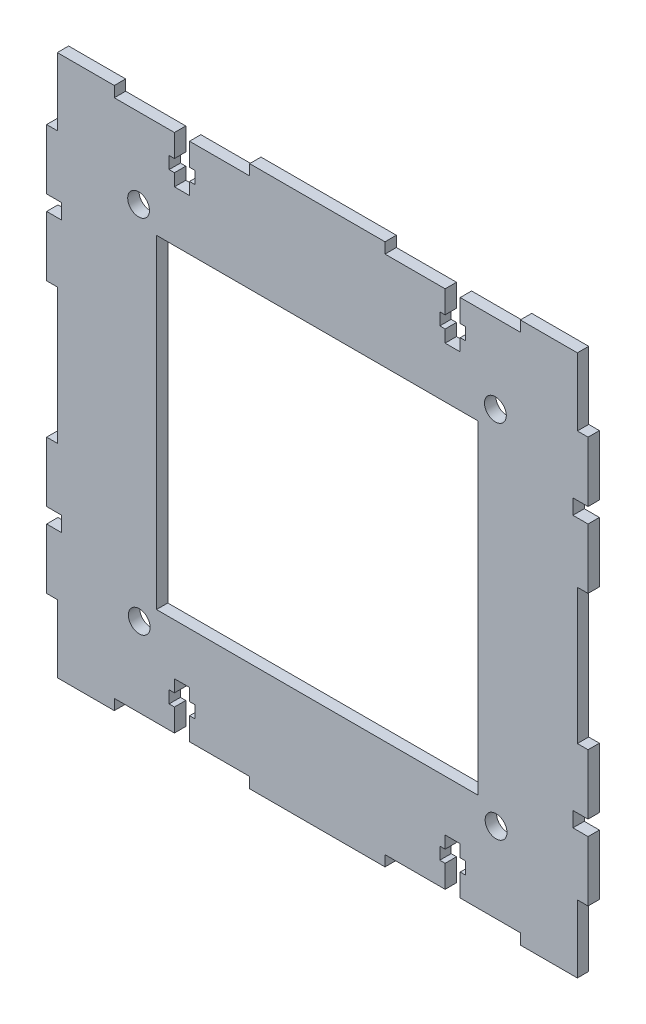
from build123d import *

# Parameters (mm, degrees)
SKETCH1_R           = 3.05
SKETCH1_W           = 89.973098966
SKETCH1_H           = 90.646237781
BOSS_EXTRUDE1_DEPTH = 3.175


with BuildPart() as part:
    # Sketch1 → Boss-Extrude1 (new body)
    with BuildSketch(Plane.XY):
        Polygon((134.366277122, 315.825463089), (134.366277122, 296.898356199), (131.385630367, 296.898356199), (131.385630367, 280.082540759), (135.608213269, 280.082540759), (135.608213269, 277.971249308), (135.608213269, 275.859957857), (131.385630367, 275.859957857), (131.385630367, 259.044142417), (134.366277122, 259.044142417), (134.366277122, 221.189928636), (131.385630367, 221.189928636), (131.385630367, 204.374113196), (135.608213269, 204.374113196), (135.608213269, 202.262821745), (135.608213269, 200.151530294), (131.385630367, 200.151530294), (131.385630367, 183.335714854), (134.366277122, 183.335714854), (134.366277122, 164.408607964), (150.312737258, 164.408607964), (150.312737258, 167.389254718), (167.128552698, 167.389254718), (167.128552698, 173.698290348), (165.63822932, 173.698290348), (165.63822932, 177.126034116), (167.128552698, 177.126034116), (167.128552698, 180.553777884), (171.3511356, 180.553777884), (171.3511356, 177.126034116), (172.841458977, 177.126034116), (172.841458977, 173.698290348), (171.3511356, 173.698290348), (171.3511356, 167.389254718), (188.166951039, 167.389254718), (188.166951039, 164.408607964), (226.021164821, 164.408607964), (226.021164821, 167.389254718), (242.83698026, 167.389254718), (242.83698026, 173.698290348), (241.346656883, 173.698290348), (241.346656883, 177.126034116), (242.83698026, 177.126034116), (242.83698026, 180.553777884), (247.059563162, 180.553777884), (247.059563162, 177.126034116), (248.54988654, 177.126034116), (248.54988654, 173.698290348), (247.059563162, 173.698290348), (247.059563162, 167.389254718), (263.875378602, 167.389254718), (263.875378602, 164.408607964), (279.821838738, 164.408607964), (279.821838738, 183.335714854), (282.802485493, 183.335714854), (282.802485493, 200.151530294), (278.579902591, 200.151530294), (278.579902591, 202.262821745), (278.579902591, 204.374113196), (282.802485493, 204.374113196), (282.802485493, 221.189928636), (279.821838738, 221.189928636), (279.821838738, 259.044142417), (282.802485493, 259.044142417), (282.802485493, 275.859957857), (278.579902591, 275.859957857), (278.579902591, 277.971249308), (278.579902591, 280.082540759), (282.802485493, 280.082540759), (282.802485493, 296.898356199), (279.821838738, 296.898356199), (279.821838738, 315.825463089), (263.875378602, 315.825463089), (263.875378602, 312.844816335), (247.059563162, 312.844816335), (247.059563162, 306.535780705), (248.54988654, 306.535780705), (248.54988654, 303.108036937), (247.059563162, 303.108036937), (247.059563162, 299.680293169), (242.83698026, 299.680293169), (242.83698026, 303.108036937), (241.346656883, 303.108036937), (241.346656883, 306.535780705), (242.83698026, 306.535780705), (242.83698026, 312.844816335), (226.021164821, 312.844816335), (226.021164821, 315.825463089), (188.166951039, 315.825463089), (188.166951039, 312.844816335), (171.3511356, 312.844816335), (171.3511356, 306.535780705), (172.841458977, 306.535780705), (172.841458977, 303.108036937), (171.3511356, 303.108036937), (171.3511356, 299.680293169), (167.128552698, 299.680293169), (167.128552698, 303.108036937), (165.63822932, 303.108036937), (165.63822932, 306.535780705), (167.128552698, 306.535780705), (167.128552698, 312.844816335), (150.312737258, 312.844816335), (150.312737258, 315.825463089), align=None)
        with Locations((157.107508447, 290.442033214)):
            Circle(SKETCH1_R, mode=Mode.SUBTRACT)
        with Locations(Location((256.893063872, 290.685795432, 0), (0, 0, 180))):
            Circle(SKETCH1_R, mode=Mode.SUBTRACT)
        with Locations((257.080607413, 189.795795432)):
            Circle(SKETCH1_R, mode=Mode.SUBTRACT)
        with Locations(Location((157.295282053, 189.548275621, 0), (0, 0, 180))):
            Circle(SKETCH1_R, mode=Mode.SUBTRACT)
        with Locations((207.09405793, 240.117035527)):
            Rectangle(SKETCH1_W, SKETCH1_H, mode=Mode.SUBTRACT)
    extrude(amount=BOSS_EXTRUDE1_DEPTH)


solid = part.part
